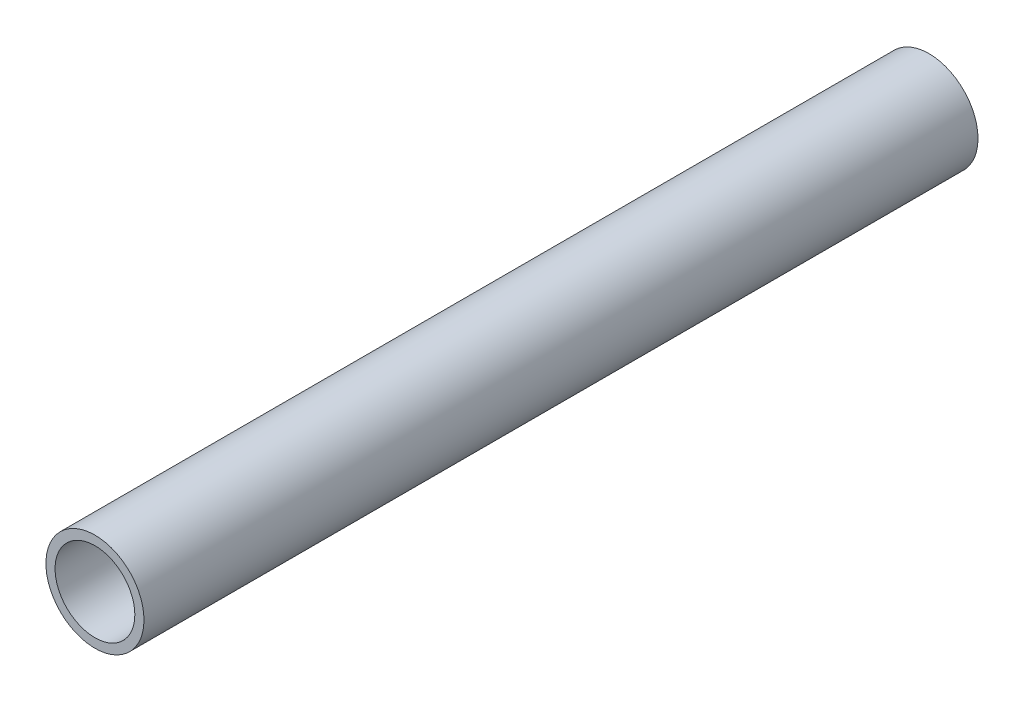
from build123d import *

# Parameters (mm, degrees)
SKETCH1_R           = 4.7625
SKETCH1_R_2         = 3.8735
BOSS_EXTRUDE1_DEPTH = 81


with BuildPart() as part:
    # Sketch1 → Boss-Extrude1 (new body)
    with BuildSketch(Plane.XY):
        Circle(SKETCH1_R)
        Circle(SKETCH1_R_2, mode=Mode.SUBTRACT)
    extrude(amount=BOSS_EXTRUDE1_DEPTH)


solid = part.part
